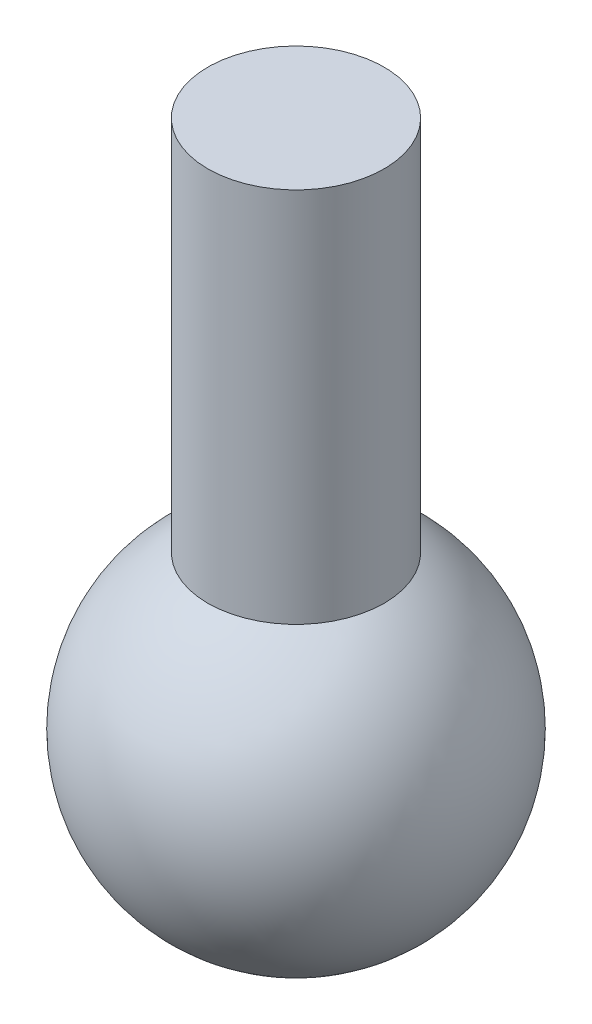
from build123d import *


with BuildPart() as part:
    # Sketch1 → Revolve1 (revolve)
    with BuildSketch(Plane.XY):
        with BuildLine():
            Line((0, 0), (0, 12))
            Line((0, 12), (1.5, 12))
            Line((1.5, 12), (1.5, 5.598076211))
            ThreePointArc((1.5, 5.598076211), (2.897777479, 2.223542865), (0, 0))
        make_face()
    revolve(axis=Axis((0, 0, 0), (0, -1, 0)))


solid = part.part
